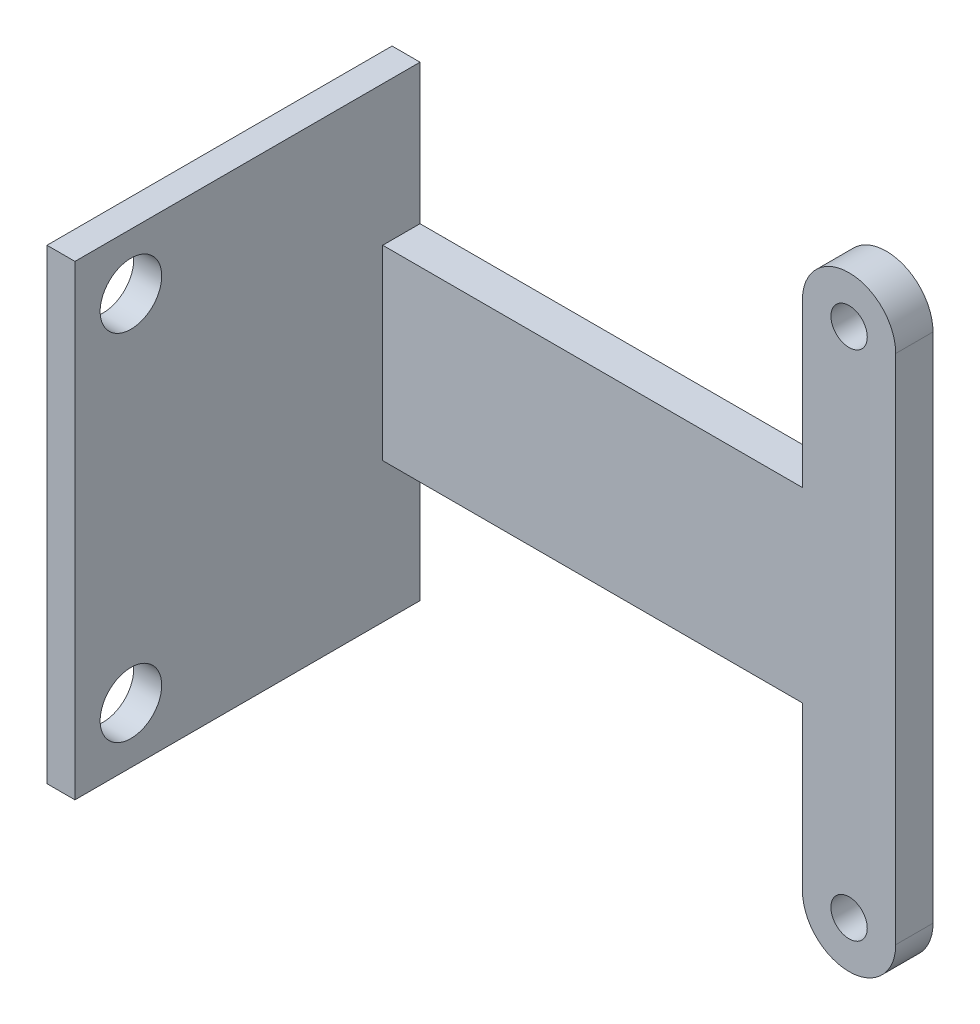
from build123d import *

# Parameters (mm, degrees)
BOSS_EXTRUDE2_DEPTH      = 2
BOSS_EXTRUDE2_DEPTH_BACK = 2
SKETCH1_3_W              = 45
SKETCH1_3_H              = 20
BOSS_EXTRUDE3_DEPTH      = 35
M3_5_CLEARANCE_HOLE2_D   = 3.9
M6_CLEARANCE_HOLE2_D     = 6.6


with BuildPart() as part:
    # Sketch1<3> → Boss-Extrude2 (new, two sides: drawn at the far end of the back side and taken through both)
    with BuildSketch(Plane.XY.offset(-BOSS_EXTRUDE2_DEPTH_BACK)):
        with BuildLine():
            Line((-18.78, 17.478483309), (-8.78, 17.478483309))
            Line((-8.78, 17.478483309), (-8.78, 27.45))
            ThreePointArc((-8.78, 27.45), (-13.78, 32.45), (-18.78, 27.45))
            Line((-18.78, 27.45), (-18.78, 17.478483309))
        make_face()
        Polygon((-18.78, -10), (-18.78, -17.478483309), (-8.78, -17.478483309), (-8.78, 17.478483309), (-18.78, 17.478483309), (-18.78, 10), align=None)
        with BuildLine():
            Line((-8.78, -17.478483309), (-18.78, -17.478483309))
            Line((-18.78, -17.478483309), (-18.78, -27.45))
            ThreePointArc((-18.78, -27.45), (-13.78, -32.45), (-8.78, -27.45))
            Line((-8.78, -27.45), (-8.78, -17.478483309))
        make_face()
        with Locations((-41.28, 0)):
            Rectangle(SKETCH1_3_W, SKETCH1_3_H)
        Polygon((-63.78, -25), (-63.78, -10), (-63.78, 10), (-63.78, 25), (-66.78, 25), (-66.78, -25), align=None)
    extrude(amount=BOSS_EXTRUDE2_DEPTH + BOSS_EXTRUDE2_DEPTH_BACK)

    # Sketch1<4> → Boss-Extrude3 (add)
    with BuildSketch(Plane.XY):
        Polygon((-63.78, -25), (-63.78, -10), (-63.78, 10), (-63.78, 25), (-66.78, 25), (-66.78, -25), align=None)
    extrude(amount=BOSS_EXTRUDE3_DEPTH)

    # M3.5 Clearance Hole2 (through all)
    with Locations(Plane(origin=(0, 0, -2), x_dir=(-1, 0, 0), z_dir=(0, 0, -1))):
        with Locations((13.78, 27.45), (13.78, -27.45)):
            Hole(M3_5_CLEARANCE_HOLE2_D / 2)

    # M6 Clearance Hole2 (through all)
    with Locations(Plane(origin=(-63.78, 0, 0), x_dir=(0, 0, -1), z_dir=(1, 0, 0))):
        with Locations((-29, 19)):
            m6_clearance_hole2 = Hole(M6_CLEARANCE_HOLE2_D / 2)

    # Mirror1: M6 Clearance Hole2 across plane
    add(m6_clearance_hole2.mirror(Plane.ZX), mode=Mode.SUBTRACT)


solid = part.part
